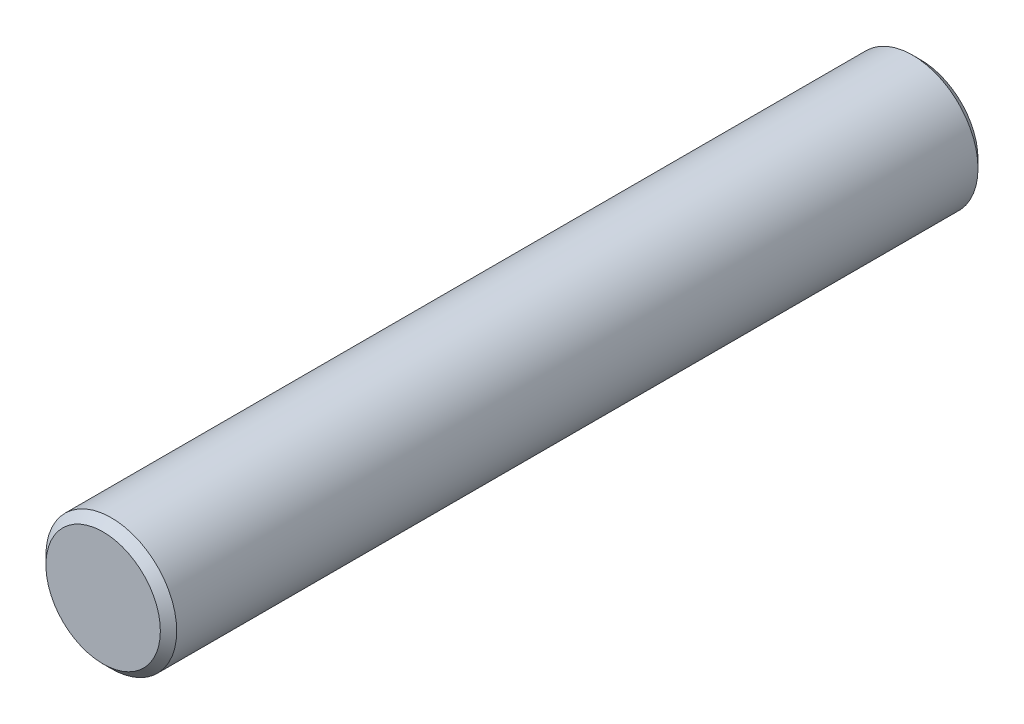
from build123d import *

# Parameters (mm, degrees)
SKETCH1_R            = 4
CORPO_DEPTH          = 50
QUEBRA_DE_CANTO_SIZE = 0.5


with BuildPart() as part:
    # Sketch1 → Corpo (new body)
    with BuildSketch(Plane.XY):
        Circle(SKETCH1_R)
    extrude(amount=-CORPO_DEPTH)

    # Quebra de Canto
    quebra_de_canto_edges = [part.edges().sort_by_distance(p)[0] for p in [
        (-4, 0, 0),
        (-4, 0, -50),
    ]]
    chamfer(quebra_de_canto_edges, length=QUEBRA_DE_CANTO_SIZE)


solid = part.part
